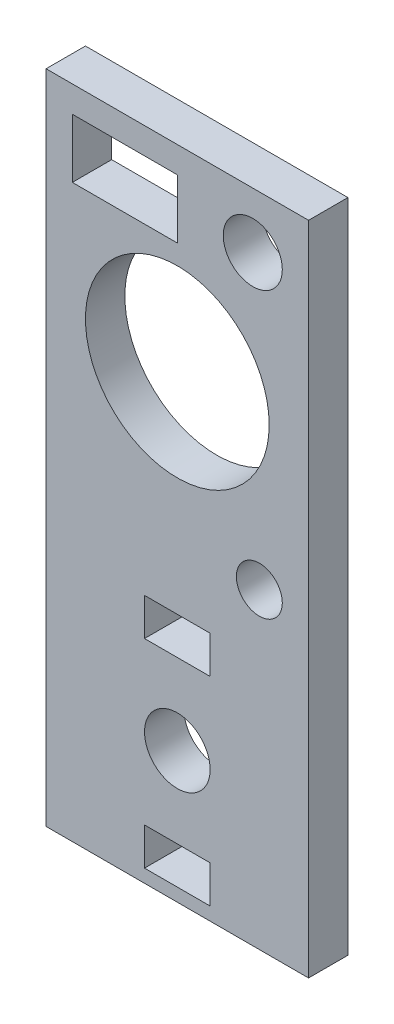
from build123d import *

# Parameters (mm, degrees)
SKETCH1_W           = 20
SKETCH1_H           = 50
SKETCH1_R           = 1.75
SKETCH1_R_2         = 2.25
SKETCH1_R_3         = 2.5
SKETCH1_R_4         = 7
SKETCH1_W_2         = 8
SKETCH1_H_2         = 4.5
SKETCH1_W_3         = 5
SKETCH1_H_3         = 2.85
BOSS_EXTRUDE1_DEPTH = 3


with BuildPart() as part:
    # Sketch1 → Boss-Extrude1 (new body)
    with BuildSketch(Plane.XY):
        with Locations((10, 25)):
            Rectangle(SKETCH1_W, SKETCH1_H)
        with Locations((16.25, 23.75)):
            Circle(SKETCH1_R, mode=Mode.SUBTRACT)
        with Locations((15.75, 45.75)):
            Circle(SKETCH1_R_2, mode=Mode.SUBTRACT)
        with Locations((10, 10)):
            Circle(SKETCH1_R_3, mode=Mode.SUBTRACT)
        with Locations((10, 35)):
            Circle(SKETCH1_R_4, mode=Mode.SUBTRACT)
        with Locations((6, 45.75)):
            Rectangle(SKETCH1_W_2, SKETCH1_H_2, mode=Mode.SUBTRACT)
        with Locations((10, 2.425)):
            Rectangle(SKETCH1_W_3, SKETCH1_H_3, mode=Mode.SUBTRACT)
        with Locations((10, 17.575)):
            Rectangle(SKETCH1_W_3, SKETCH1_H_3, mode=Mode.SUBTRACT)
    extrude(amount=BOSS_EXTRUDE1_DEPTH)


solid = part.part
